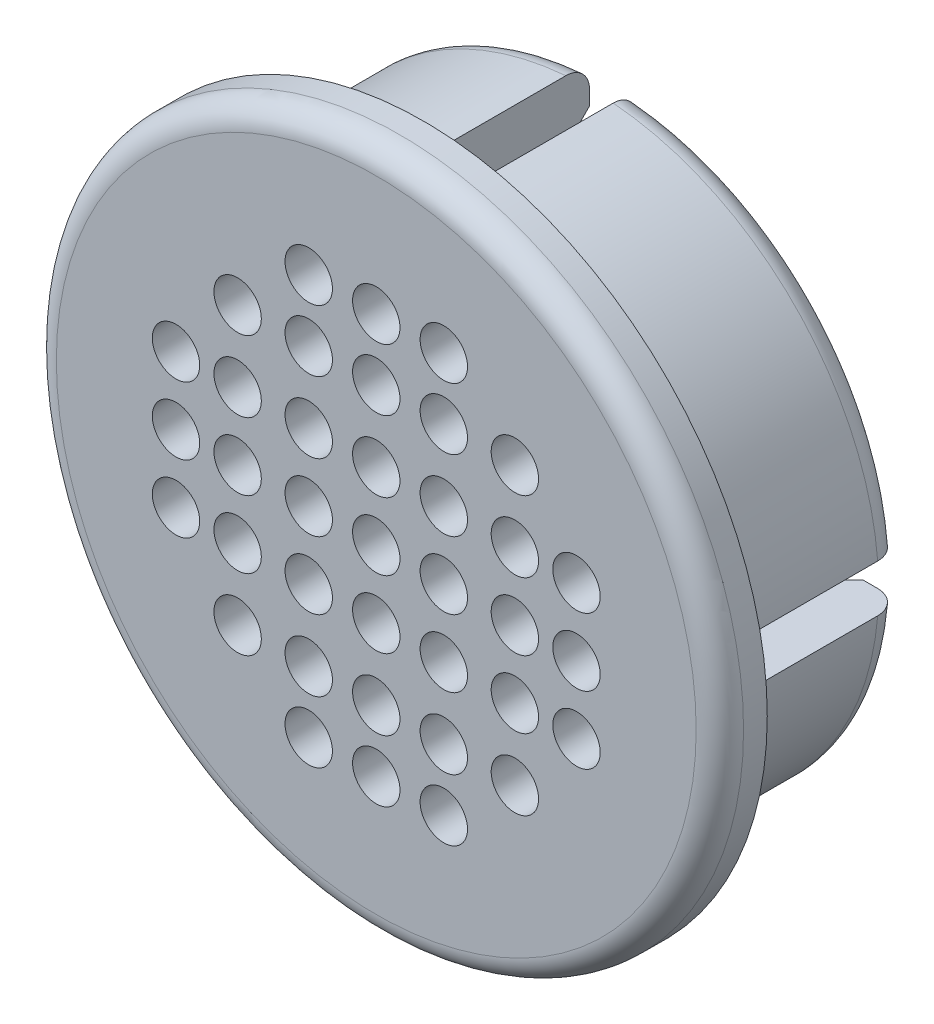
from build123d import *

# Parameters (mm, degrees)
SKETCH3_R          = 0.5
CUT_EXTRUDE1_DEPTH = 10
FILLET1_R          = 0.5
CHAMFER1_SIZE      = 0.2
SKETCH4_W          = 1
SKETCH4_H          = 12.5
SKETCH4_W_2        = 12.5
SKETCH4_H_2        = 1
CUT_EXTRUDE2_DEPTH = 4


with BuildPart() as part:
    # Sketch2 → Revolve1 (revolve)
    with BuildSketch(Plane(origin=(0, 0, 0), x_dir=(0, 0, -1), z_dir=(1, 0, 0)), mode=Mode.PRIVATE) as revolve1_sk:
        Polygon((0, 0), (0, 7.25), (1, 7.25), (1, 6.1), (5, 6.1), (5, 5.1), (1, 5.1), (1, 0), align=None)
    revolve(revolve1_sk.sketch.rotate(Axis((0, 0, 0), (0, 0, -1)), 90), axis=Axis((0, 0, 0), (0, 0, -1)))

    # Sketch3 → Cut-Extrude1 (cut)
    with BuildSketch(Plane.XY):
        with Locations((-1.425, 1.425)):
            Circle(SKETCH3_R)
        with Locations((1.425, 1.425)):
            Circle(SKETCH3_R)
        with Locations((0, 1.425)):
            Circle(SKETCH3_R)
        with Locations((1.425, 0)):
            Circle(SKETCH3_R)
        with Locations((1.425, -1.425)):
            Circle(SKETCH3_R)
        with Locations((0, -1.425)):
            Circle(SKETCH3_R)
        with Locations((-1.425, -1.425)):
            Circle(SKETCH3_R)
        with Locations((-1.425, 0)):
            Circle(SKETCH3_R)
        with Locations((-2.925, 2.925)):
            Circle(SKETCH3_R)
        with Locations((0, 2.925)):
            Circle(SKETCH3_R)
        with Locations((2.925, 2.925)):
            Circle(SKETCH3_R)
        with Locations((2.925, 0)):
            Circle(SKETCH3_R)
        with Locations((2.925, -2.925)):
            Circle(SKETCH3_R)
        with Locations((0, -2.925)):
            Circle(SKETCH3_R)
        with Locations((-2.925, -2.925)):
            Circle(SKETCH3_R)
        with Locations((-2.925, 0)):
            Circle(SKETCH3_R)
        with Locations((-1.425, 2.925)):
            Circle(SKETCH3_R)
        with Locations((1.425, 2.925)):
            Circle(SKETCH3_R)
        with Locations((2.925, 1.425)):
            Circle(SKETCH3_R)
        with Locations((2.925, -1.425)):
            Circle(SKETCH3_R)
        with Locations((1.425, -2.925)):
            Circle(SKETCH3_R)
        with Locations((-1.425, -2.925)):
            Circle(SKETCH3_R)
        with Locations((-2.925, -1.425)):
            Circle(SKETCH3_R)
        with Locations((-2.925, 1.425)):
            Circle(SKETCH3_R)
        with Locations((-1.425, 4.225)):
            Circle(SKETCH3_R)
        with Locations((0, 4.225)):
            Circle(SKETCH3_R)
        with Locations((1.425, 4.225)):
            Circle(SKETCH3_R)
        with Locations((4.225, 1.425)):
            Circle(SKETCH3_R)
        with Locations((4.225, 0)):
            Circle(SKETCH3_R)
        with Locations((4.225, -1.425)):
            Circle(SKETCH3_R)
        with Locations((1.425, -4.225)):
            Circle(SKETCH3_R)
        with Locations((0, -4.225)):
            Circle(SKETCH3_R)
        with Locations((-1.425, -4.225)):
            Circle(SKETCH3_R)
        with Locations((-4.225, -1.425)):
            Circle(SKETCH3_R)
        with Locations((-4.225, 0)):
            Circle(SKETCH3_R)
        with Locations((-4.225, 1.425)):
            Circle(SKETCH3_R)
        Circle(SKETCH3_R)
    extrude(amount=-CUT_EXTRUDE1_DEPTH, mode=Mode.SUBTRACT)

    # Fillet1
    fillet1_edges = [part.edges().sort_by_distance(p)[0] for p in [
        (-6.1, 0, -5),
        (-7.25, 0, 0),
    ]]
    fillet(fillet1_edges, radius=FILLET1_R)

    # Chamfer1
    chamfer1_edges = [part.edges().sort_by_distance(p)[0] for p in [
        (-5.1, 0, -5),
    ]]
    chamfer(chamfer1_edges, length=CHAMFER1_SIZE)

    # Sketch4 → Cut-Extrude2 (cut)
    with BuildSketch(Plane(origin=(0, 0, -5), x_dir=(-1, 0, 0), z_dir=(0, 0, -1))):
        Rectangle(SKETCH4_W, SKETCH4_H)
        Rectangle(SKETCH4_W_2, SKETCH4_H_2)
    extrude(amount=-CUT_EXTRUDE2_DEPTH, mode=Mode.SUBTRACT)


solid = part.part
